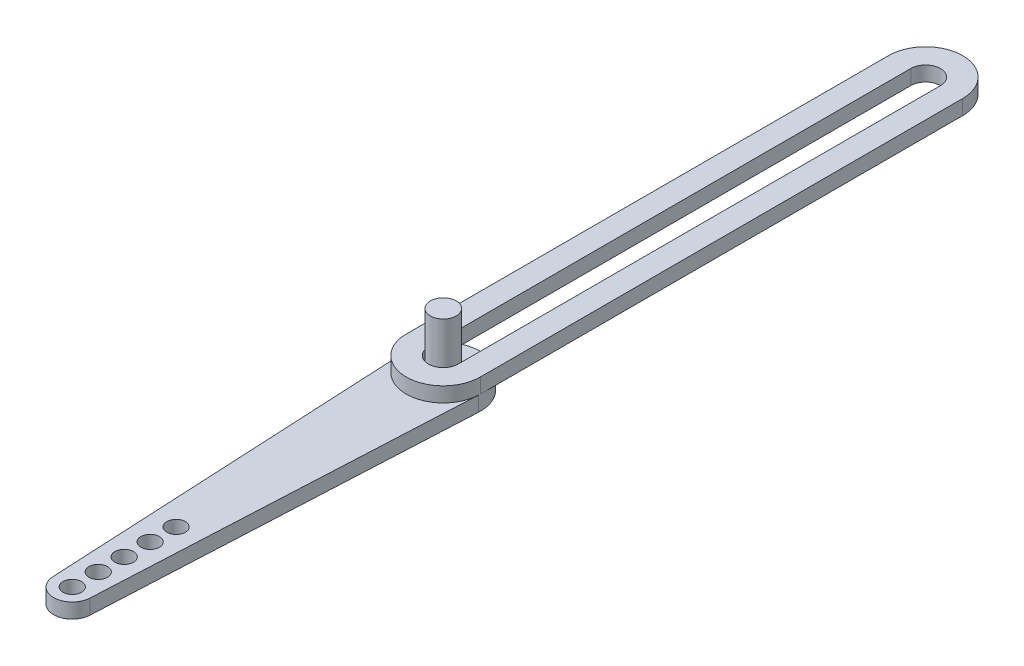
from build123d import *

# Parameters (mm, degrees)
SKETCH1_R           = 3.5
BOSS_EXTRUDE1_DEPTH = 15
BOSS_EXTRUDE2_DEPTH = 4
SKETCH3_R           = 2.5
CUT_EXTRUDE1_DEPTH  = 108.172757733
LPATTERN1_COUNT     = 5
LPATTERN1_PITCH     = 7
BOSS_EXTRUDE3_START = 4
BOSS_EXTRUDE3_DEPTH = 4
SKETCH5_R           = 6.5
BOSS_EXTRUDE4_DEPTH = 2


with BuildPart() as part:
    # Sketch1 → Boss-Extrude1 (new body)
    with BuildSketch(Plane(origin=(0, 0, 0), x_dir=(1, 0, 0), z_dir=(0, 1, 0))):
        with Locations(Location((0, 0, 0), (0, 0, 270))):
            Circle(SKETCH1_R)
    extrude(amount=-BOSS_EXTRUDE1_DEPTH)

    # Sketch2 → Boss-Extrude2 (add)
    with BuildSketch(Plane.XZ.offset(15)):
        with BuildLine():
            Line((9.987492178, 0.5), (4.993746089, 100.25))
            ThreePointArc((4.993746089, 100.25), (0, 105), (-4.993746089, 100.25))
            Line((-4.993746089, 100.25), (-9.987492178, 0.5))
            ThreePointArc((-9.987492178, 0.5), (0, -10), (9.987492178, 0.5))
        make_face()
    extrude(amount=BOSS_EXTRUDE2_DEPTH)

    # Sketch3 → Cut-Extrude1 (cut, through all)
    with BuildSketch(Plane.XZ.offset(19)):
        with Locations(Location((0, 100, 0), (0, 0, 270))):
            Circle(SKETCH3_R)
    cut_extrude1 = extrude(amount=-CUT_EXTRUDE1_DEPTH, mode=Mode.SUBTRACT)

    # LPattern1: Cut-Extrude1 ×5
    with Locations(*[(0, 0, -i * LPATTERN1_PITCH) for i in range(1, LPATTERN1_COUNT)]):
        add(cut_extrude1, mode=Mode.SUBTRACT)

    # Sketch4 → Boss-Extrude3 (add)
    with BuildSketch(Plane(origin=(0, -15, 0), x_dir=(1, 0, 0), z_dir=(0, 1, 0)).offset(BOSS_EXTRUDE3_START)):
        with BuildLine():
            Line((-10, 0), (-10, 130))
            ThreePointArc((-10, 130), (0, 140), (10, 130))
            Line((10, 130), (10, 0))
            ThreePointArc((10, 0), (0, -10), (-10, 0))
        make_face()
        with BuildLine():
            Line((-4, 0), (-4, 130))
            ThreePointArc((-4, 130), (0, 134), (4, 130))
            Line((4, 130), (4, 0))
            ThreePointArc((4, 0), (0, -4), (-4, 0))
        make_face(mode=Mode.SUBTRACT)
    extrude(amount=-BOSS_EXTRUDE3_DEPTH)

    # Sketch5 → Boss-Extrude4 (add)
    with BuildSketch(Plane.XZ.offset(19)):
        with Locations(Location((0, 0, 0), (0, 0, 270))):
            Circle(SKETCH5_R)
    extrude(amount=BOSS_EXTRUDE4_DEPTH)


solid = part.part
